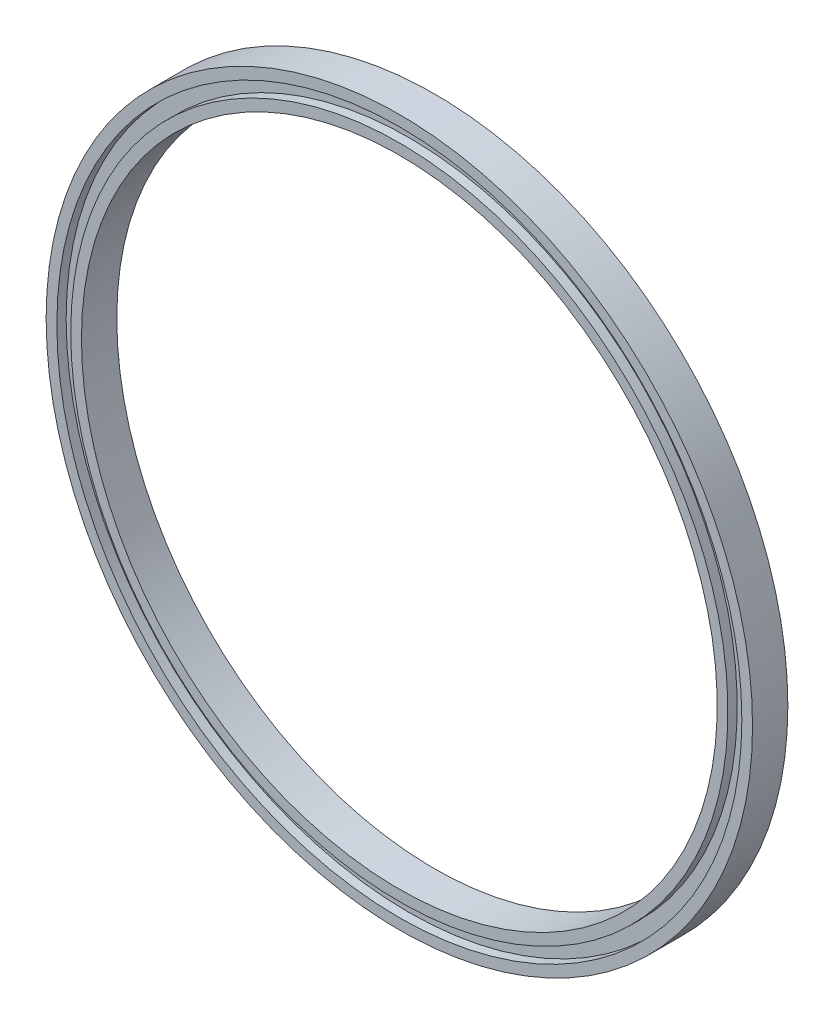
from build123d import *


with BuildPart() as part:
    # 草图1 → 旋转1 (revolve)
    with BuildSketch(Plane(origin=(0, 0, 0), x_dir=(0, 0, -1), z_dir=(1, 0, 0)), mode=Mode.PRIVATE) as revolve_1_sk:
        Polygon((-3.175, 63.5), (3.175, 63.5), (3.175, 61.575), (1.5, 61.575), (1.5, 59.075), (3.175, 59.075), (3.175, 57.15), (-3.175, 57.15), (-3.175, 59.075), (-1.5, 59.075), (-1.5, 61.575), (-3.175, 61.575), align=None)
    revolve(revolve_1_sk.sketch.rotate(Axis((0, 0, 0), (0, 0, 1)), 90), axis=Axis((0, 0, 0), (0, 0, 1)))


solid = part.part
